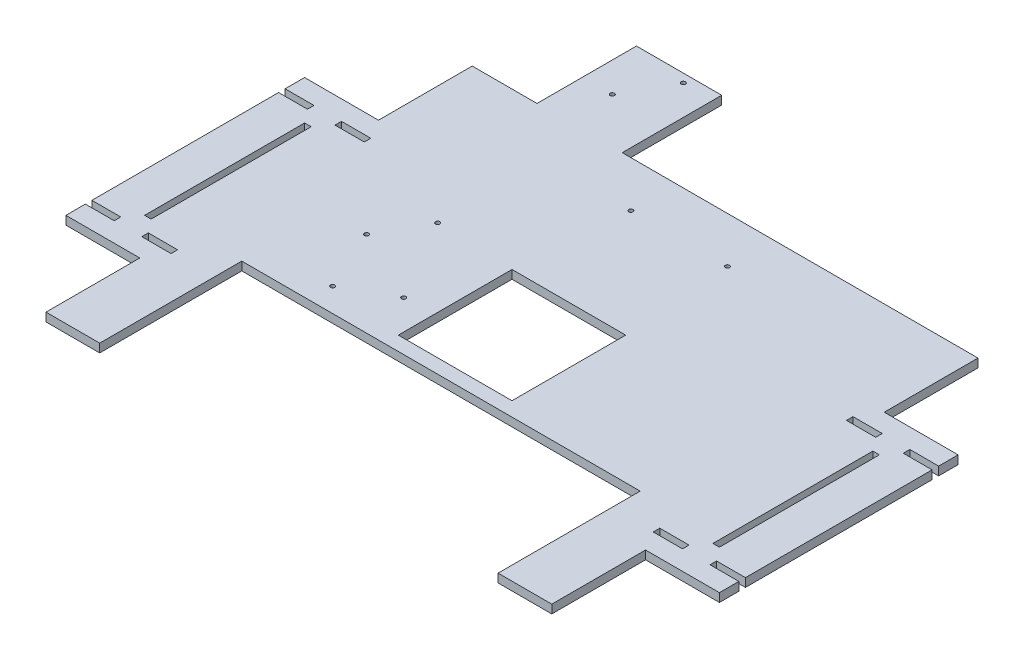
from build123d import *

# Parameters (mm, degrees)
SKETCH1_W           = 115
SKETCH1_H           = 150
BOSS_EXTRUDE1_DEPTH = 3
SKETCH2_W           = 26
SKETCH2_H           = 66
SKETCH2_W_2         = 70.1
SKETCH2_H_2         = 50
CUT_EXTRUDE1_DEPTH  = 3
SKETCH5_W           = 10.3
SKETCH5_H           = 2.3
SKETCH5_W_2         = 2.3
SKETCH5_H_2         = 56.3
CUT_EXTRUDE2_DEPTH  = 3
SKETCH9_W           = 30
SKETCH9_H           = 3
BOSS_EXTRUDE2_DEPTH = 35
SKETCH8_R           = 0.75
SKETCH8_W           = 40
SKETCH8_H           = 40
CUT_EXTRUDE3_DEPTH  = 205.609994868


with BuildPart() as part:
    # Sketch1 → Boss-Extrude1 (new body)
    with BuildSketch(Plane(origin=(0, 0, 0), x_dir=(1, 0, 0), z_dir=(0, 1, 0))):
        Rectangle(SKETCH1_W, SKETCH1_H)
    extrude(amount=-BOSS_EXTRUDE1_DEPTH)

    # Sketch2 → Cut-Extrude1 (cut)
    with BuildSketch(Plane(origin=(0, 0, 0), x_dir=(1, 0, 0), z_dir=(0, 1, 0))):
        with Locations((44.5, -75)):
            Rectangle(SKETCH2_W, SKETCH2_H)
        with Locations((44.5, 75)):
            Rectangle(SKETCH2_W, SKETCH2_H)
        with Locations((-22.45, -50)):
            Rectangle(SKETCH2_W_2, SKETCH2_H_2)
    extrude(amount=-CUT_EXTRUDE1_DEPTH, mode=Mode.SUBTRACT)

    # Sketch5 → Cut-Extrude2 (cut)
    with BuildSketch(Plane.XZ.offset(3)):
        with Locations((32.5, 34)):
            Rectangle(SKETCH5_W, SKETCH5_H)
        with Locations((42.5, 0)):
            Rectangle(SKETCH5_W_2, SKETCH5_H_2)
        with Locations((52.5, 34)):
            Rectangle(SKETCH5_W, SKETCH5_H)
        with Locations((32.5, -34)):
            Rectangle(SKETCH5_W, SKETCH5_H)
        with Locations((52.5, -34)):
            Rectangle(SKETCH5_W, SKETCH5_H)
    extrude(amount=-CUT_EXTRUDE2_DEPTH, mode=Mode.SUBTRACT)

    # Mirror1: part across plane


with BuildPart() as part_1:
    add(part.part)
    add(part.part.mirror(Plane(origin=(-57.5, -3, 75), x_dir=(0, 0, 1), z_dir=(-1, 0, 0))))

    # Sketch9 → Boss-Extrude2 (add)
    with BuildSketch(Plane(origin=(0, 0, -75), x_dir=(-1, 0, 0), z_dir=(0, 0, -1))):
        with Locations((108.7, -1.5)):
            Rectangle(SKETCH9_W, SKETCH9_H)
    extrude(amount=BOSS_EXTRUDE2_DEPTH)

    # Sketch8 → Cut-Extrude3 (cut, through all)
    with BuildSketch(Plane.XZ.offset(3)):
        with Locations(Location((-74.5, -58.832861148, 0), (0, 0, 270))):
            Circle(SKETCH8_R)
        with Locations(Location((-40.5, -58.832861148, 0), (0, 0, 270))):
            Circle(SKETCH8_R)
        with Locations(Location((-104.8, -21.135456144, 0), (0, 0, 270))):
            Circle(SKETCH8_R)
        with Locations(Location((-113.8, -5.135456144, 0), (0, 0, 270))):
            Circle(SKETCH8_R)
        with Locations(Location((-87.980765301, 7.641432582, 0), (0, 0, 270))):
            Circle(SKETCH8_R)
        with Locations(Location((-103.980765301, 16.641432582, 0), (0, 0, 270))):
            Circle(SKETCH8_R)
        with Locations(Location((-104.2, -107, 0), (0, 0, 270))):
            Circle(SKETCH8_R)
        with Locations(Location((-113.2, -91, 0), (0, 0, 270))):
            Circle(SKETCH8_R)
        with Locations((-57.5, 0)):
            Rectangle(SKETCH8_W, SKETCH8_H)
    extrude(amount=-CUT_EXTRUDE3_DEPTH, mode=Mode.SUBTRACT)


solid = part_1.part
